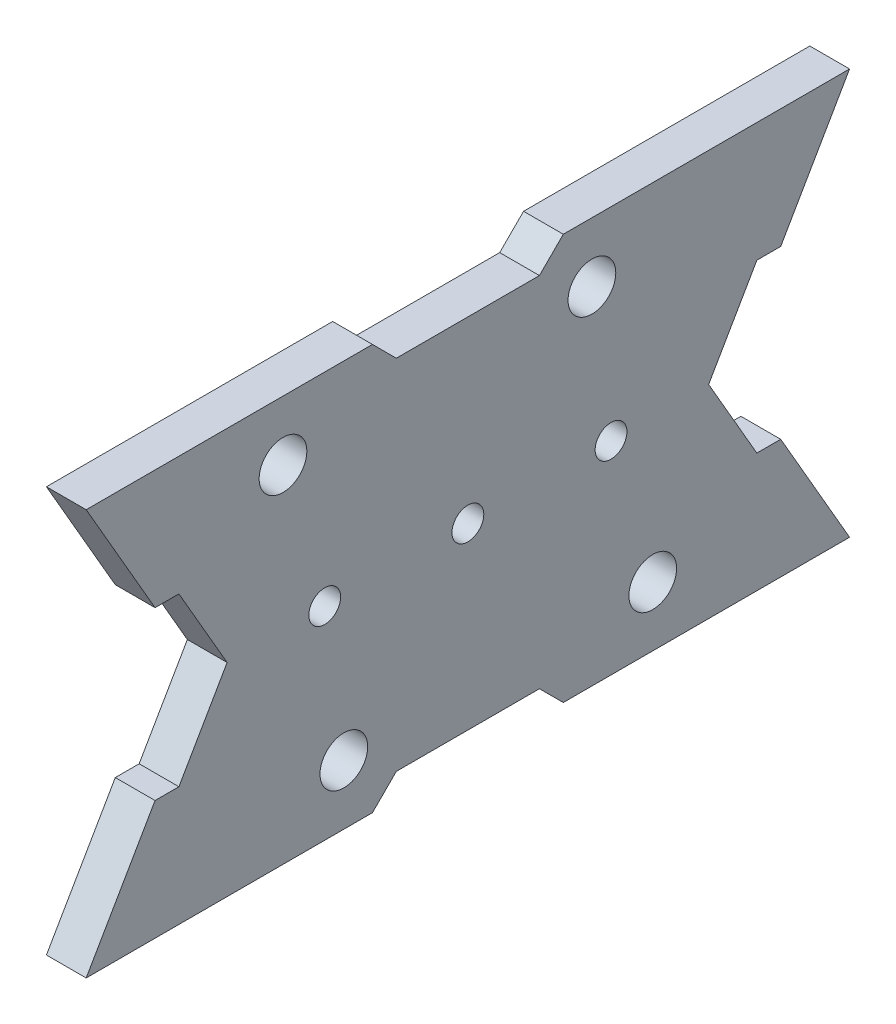
from build123d import *

# Parameters (mm, degrees)
SKETCH1_R           = 3
SKETCH1_R_2         = 2
BOSS_EXTRUDE1_DEPTH = 5


with BuildPart() as part:
    # Sketch1 → Boss-Extrude1 (new body)
    with BuildSketch(Plane(origin=(0, 0, 0), x_dir=(0, 0, -1), z_dir=(1, 0, 0))):
        Polygon((-32.401546808, -7.5), (3.598453192, -7.5), (6.598453192, -4.5), (24.598453192, -4.5), (27.598453192, -7.5), (63.598453192, -7.5), (54.938199155, 7.5), (51.938199155, 7.5), (45.876021328, 18), (51.938199155, 28.5), (54.938199155, 28.5), (63.598453192, 43.5), (27.598453192, 43.5), (24.598453192, 40.5), (6.598453192, 40.5), (3.598453192, 43.5), (-32.401546808, 43.5), (-23.74129277, 28.5), (-20.74129277, 28.5), (-14.679114943, 18), (-20.74129277, 7.5), (-23.74129277, 7.5), align=None)
        Circle(SKETCH1_R, mode=Mode.SUBTRACT)
        with Locations((38.848942605, 0)):
            Circle(SKETCH1_R, mode=Mode.SUBTRACT)
        with Locations((31.196906385, 36)):
            Circle(SKETCH1_R, mode=Mode.SUBTRACT)
        with Locations((-7.65203622, 36)):
            Circle(SKETCH1_R, mode=Mode.SUBTRACT)
        with Locations((15.598453192, 18)):
            Circle(SKETCH1_R_2, mode=Mode.SUBTRACT)
        with Locations((-2.401546808, 18)):
            Circle(SKETCH1_R_2, mode=Mode.SUBTRACT)
        with Locations((33.598453192, 18)):
            Circle(SKETCH1_R_2, mode=Mode.SUBTRACT)
    extrude(amount=BOSS_EXTRUDE1_DEPTH)


solid = part.part
